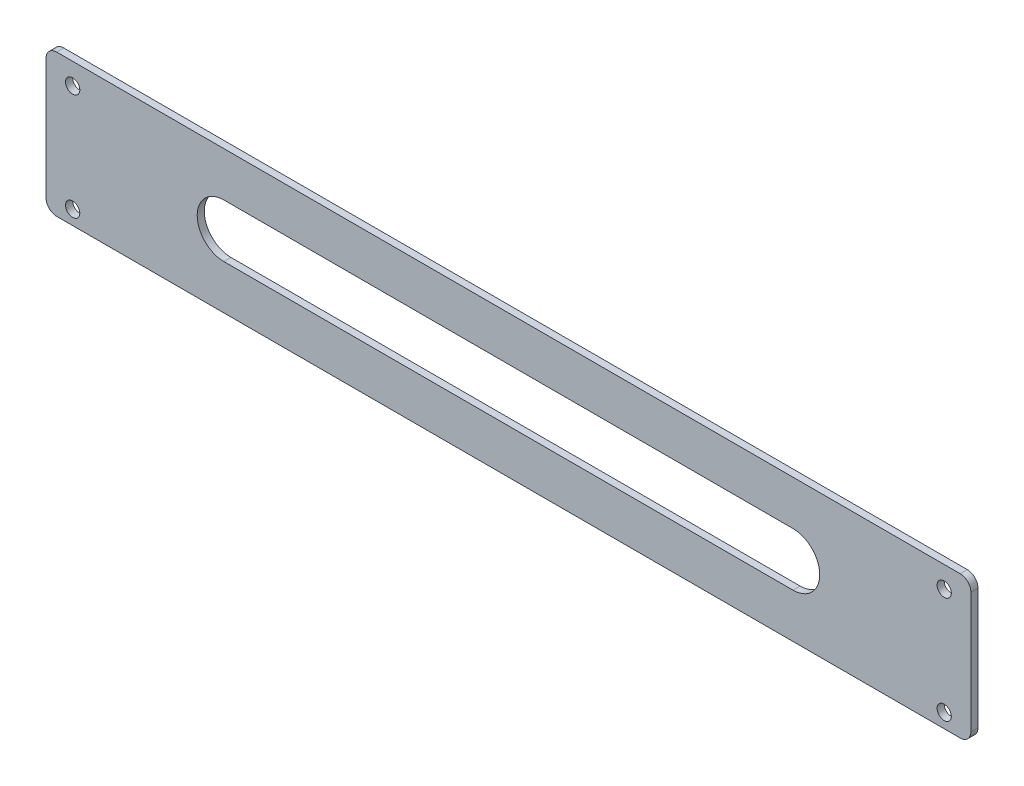
from build123d import *

# Parameters (mm, degrees)
SKETCH_1_W          = 260
SKETCH_1_H          = 40
EXTRUDE_1_DEPTH     = 2
SKETCH_3_R          = 2
CUT_EXTRUDE_2_DEPTH = 2
CUT_EXTRUDE_3_DEPTH = 132.544669219
FILLET_1_R          = 3


with BuildPart() as part:
    # 草图1 → 凸台-拉伸1 (new body)
    with BuildSketch(Plane.XY):
        Rectangle(SKETCH_1_W, SKETCH_1_H)
    extrude(amount=EXTRUDE_1_DEPTH)

    # 草图3 → 切除-拉伸2 (cut)
    with BuildSketch(Plane.XY.offset(2)):
        with Locations((-122.5, 14)):
            Circle(SKETCH_3_R)
        with Locations((-122.5, -16)):
            Circle(SKETCH_3_R)
        with Locations(Location((122.5, -16, 0), (0, 0, 180))):
            Circle(SKETCH_3_R)
        with Locations(Location((122.5, 14, 0), (0, 0, 180))):
            Circle(SKETCH_3_R)
    extrude(amount=-CUT_EXTRUDE_2_DEPTH, mode=Mode.SUBTRACT)

    # 草图4 → 切除-拉伸3 (cut, through all)
    with BuildSketch(Plane.XY.offset(2)):
        with BuildLine():
            Line((-80, 7.5), (80, 7.5))
            ThreePointArc((80, 7.5), (87.5, 0), (80, -7.5))
            Line((80, -7.5), (-80, -7.5))
            ThreePointArc((-80, -7.5), (-87.5, 0), (-80, 7.5))
        make_face()
    extrude(amount=-CUT_EXTRUDE_3_DEPTH, mode=Mode.SUBTRACT)

    # 圆角1
    fillet_1_edges = [part.edges().sort_by_distance(p)[0] for p in [
        (130, -20, 1),
        (-130, -20, 1),
        (-130, 20, 1),
        (130, 20, 1),
    ]]
    fillet(fillet_1_edges, radius=FILLET_1_R)


solid = part.part
